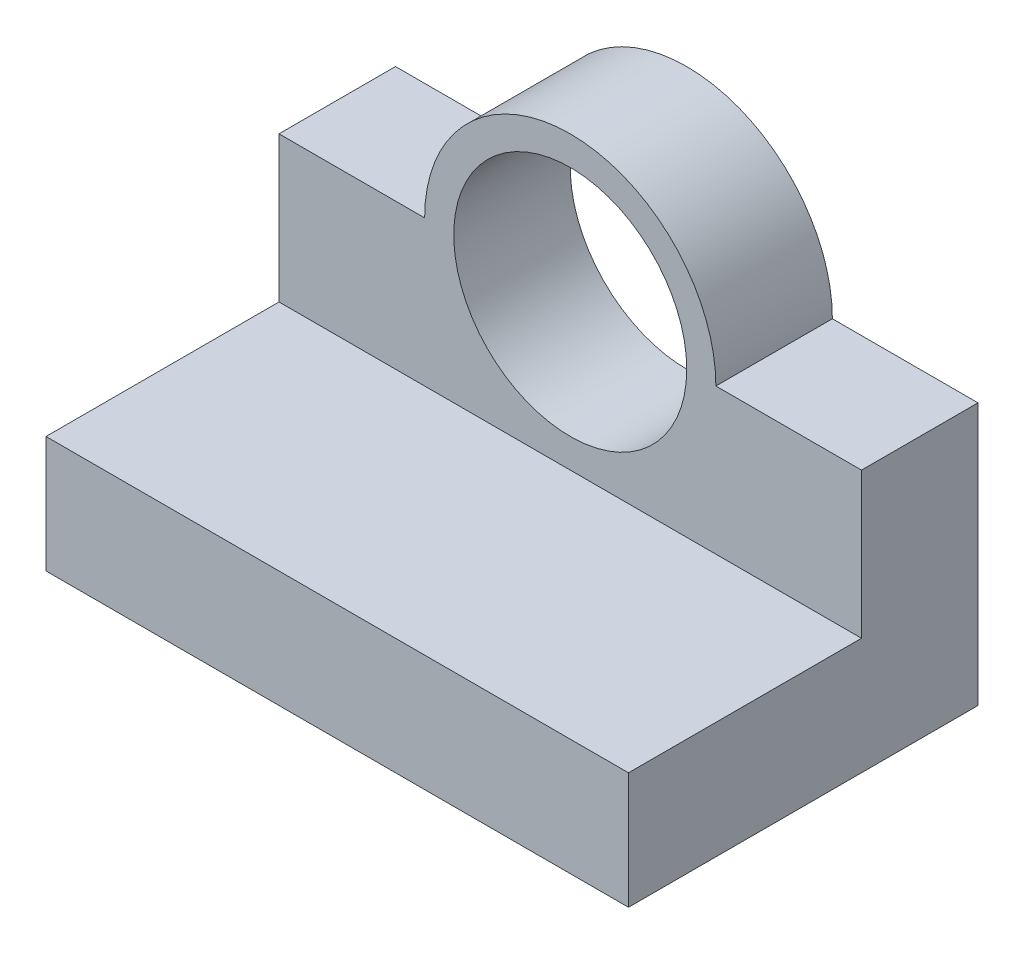
from build123d import *

# Parameters (mm, degrees)
SKETCH1_R           = 20
BOSS_EXTRUDE1_DEPTH = 20
SKETCH2_W           = 100
SKETCH2_H           = 20
BOSS_EXTRUDE2_DEPTH = 20
SKETCH3_W           = 100
SKETCH3_H           = 20
BOSS_EXTRUDE3_DEPTH = 40


with BuildPart() as part:
    # Sketch1 → Boss-Extrude1 (new body)
    with BuildSketch(Plane.XY):
        with BuildLine():
            Line((0, 0), (100, 0))
            Line((100, 0), (100, 25))
            Line((100, 25), (75, 25))
            ThreePointArc((75, 25), (50, 50), (25, 25))
            Line((25, 25), (0, 25))
            Line((0, 25), (0, 0))
        make_face()
        with Locations((50, 25)):
            Circle(SKETCH1_R, mode=Mode.SUBTRACT)
    extrude(amount=BOSS_EXTRUDE1_DEPTH)

    # Sketch2 → Boss-Extrude2 (add)
    with BuildSketch(Plane.XZ):
        with Locations((50, 10)):
            Rectangle(SKETCH2_W, SKETCH2_H)
    extrude(amount=BOSS_EXTRUDE2_DEPTH)

    # Sketch3 → Boss-Extrude3 (add)
    with BuildSketch(Plane.XY.offset(20)):
        with Locations((50, -10)):
            Rectangle(SKETCH3_W, SKETCH3_H)
    extrude(amount=BOSS_EXTRUDE3_DEPTH)


solid = part.part
